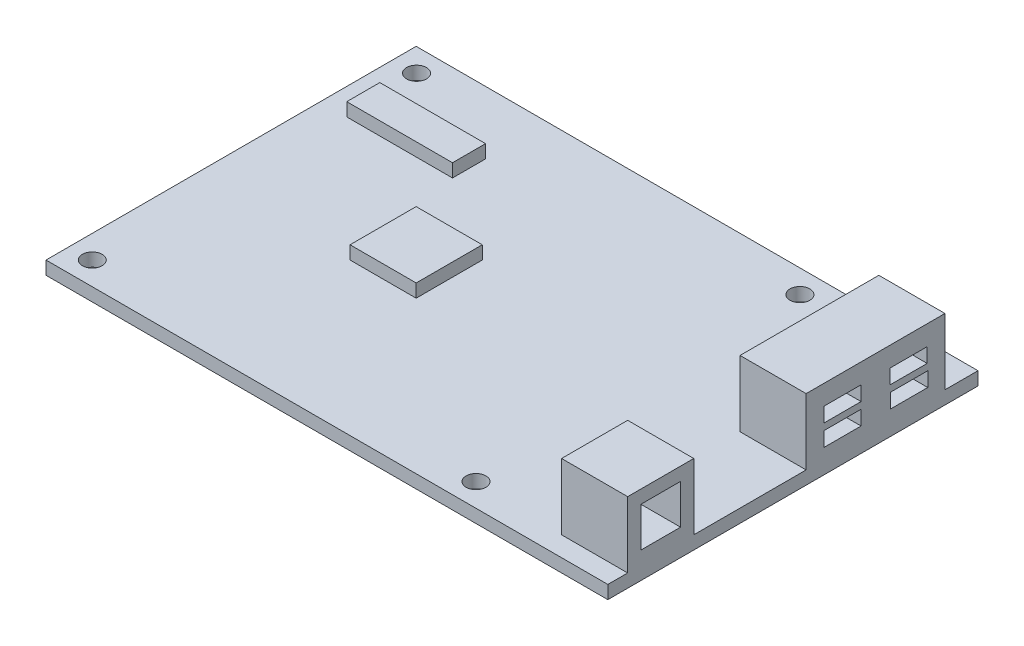
from build123d import *

# Parameters (mm, degrees)
SKETCH_1_W          = 85
SKETCH_1_H          = 56
SKETCH_1_R          = 1.5
EXTRUDE_1_DEPTH     = 2
SKETCH_2_W          = 10
SKETCH_2_H          = 10
EXTRUDE_2_DEPTH     = 2
SKETCH_3_W          = 10
SKETCH_3_H          = 21
EXTRUDE_3_DEPTH     = 10
SKETCH_4_W          = 5.6
SKETCH_4_H          = 2.2
CUT_EXTRUDE_1_DEPTH = 8
SKETCH_5_W          = 10
SKETCH_5_H          = 10
SKETCH_5_W_2        = 6
SKETCH_5_H_2        = 6
EXTRUDE_4_DEPTH     = 10
SKETCH_6_W          = 6
SKETCH_6_H          = 6
EXTRUDE_6_DEPTH     = 1
SKETCH_7_W          = 16
SKETCH_7_H          = 5
EXTRUDE_7_DEPTH     = 2


with BuildPart() as part:
    # 草图1 → 凸台-拉伸1 (new body)
    with BuildSketch(Plane(origin=(0, 0, 0), x_dir=(1, 0, 0), z_dir=(0, 1, 0))):
        Rectangle(SKETCH_1_W, SKETCH_1_H)
        with Locations(Location((-39, -24.5, 0), (0, 0, 270))):
            Circle(SKETCH_1_R, mode=Mode.SUBTRACT)
        with Locations(Location((-38.945993031, 24.5, 0), (0, 0, 270))):
            Circle(SKETCH_1_R, mode=Mode.SUBTRACT)
        with Locations(Location((19.054006969, 24.5, 0), (0, 0, 270))):
            Circle(SKETCH_1_R, mode=Mode.SUBTRACT)
        with Locations(Location((19.054006969, -24.5, 0), (0, 0, 270))):
            Circle(SKETCH_1_R, mode=Mode.SUBTRACT)
    extrude(amount=EXTRUDE_1_DEPTH)

    # 草图2 → 凸台-拉伸2 (add)
    with BuildSketch(Plane(origin=(0, 2, 0), x_dir=(1, 0, 0), z_dir=(0, 1, 0))):
        with Locations((-14.5, 0)):
            Rectangle(SKETCH_2_W, SKETCH_2_H)
    extrude(amount=EXTRUDE_2_DEPTH)

    # 草图3 → 凸台-拉伸3 (add)
    with BuildSketch(Plane(origin=(0, 2, 0), x_dir=(1, 0, 0), z_dir=(0, 1, 0))):
        with Locations((37.5, 12.5)):
            Rectangle(SKETCH_3_W, SKETCH_3_H)
    extrude(amount=EXTRUDE_3_DEPTH)

    # 草图4 → 切除-拉伸1 (cut)
    with BuildSketch(Plane(origin=(42.5, 0, 0), x_dir=(0, 0, -1), z_dir=(1, 0, 0))):
        with Locations((7.51, 7.9)):
            Rectangle(SKETCH_4_W, SKETCH_4_H)
        with Locations((7.51, 4.7)):
            Rectangle(SKETCH_4_W, SKETCH_4_H)
        with Locations((17.51, 7.9)):
            Rectangle(SKETCH_4_W, SKETCH_4_H)
        with Locations((17.6, 4.7)):
            Rectangle(SKETCH_4_W, SKETCH_4_H)
    extrude(amount=-CUT_EXTRUDE_1_DEPTH, mode=Mode.SUBTRACT)

    # 草图5 → 凸台-拉伸4 (add)
    with BuildSketch(Plane(origin=(42.5, 0, 0), x_dir=(0, 0, -1), z_dir=(1, 0, 0))):
        with Locations((-20, 7)):
            Rectangle(SKETCH_5_W, SKETCH_5_H)
        with Locations((-20, 7)):
            Rectangle(SKETCH_5_W_2, SKETCH_5_H_2, mode=Mode.SUBTRACT)
    extrude(amount=-EXTRUDE_4_DEPTH)

    # 草图6 → 凸台-拉伸6 (add)
    with BuildSketch(Plane.ZY.offset(-32.5)):
        with Locations((20, 7)):
            Rectangle(SKETCH_6_W, SKETCH_6_H)
    extrude(amount=-EXTRUDE_6_DEPTH)

    # 草图7 → 凸台-拉伸7 (add)
    with BuildSketch(Plane(origin=(0, 2, 0), x_dir=(1, 0, 0), z_dir=(0, 1, 0))):
        with Locations((-30.5, 16)):
            Rectangle(SKETCH_7_W, SKETCH_7_H)
    extrude(amount=EXTRUDE_7_DEPTH)


solid = part.part
